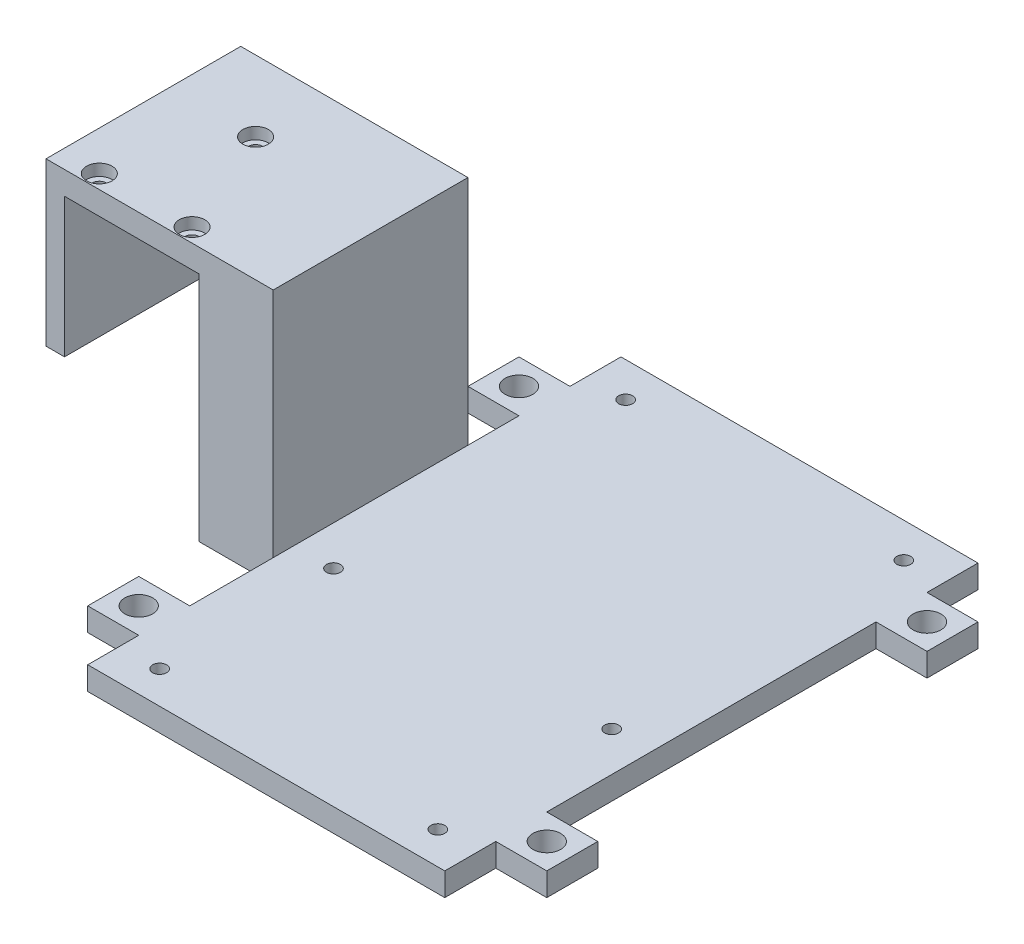
from build123d import *

# Parameters (mm, degrees)
SKETCH_1_W               = 4
SKETCH_1_H               = 42
SKETCH_1_W_2             = 29
SKETCH_1_W_3             = 16
EXTRUDE_2_DEPTH          = 90
CUT_EXTRUDE_3_DEPTH      = 30
CUT_EXTRUDE_3_DEPTH_BACK = 1
SKETCH_1_6_W             = 29
SKETCH_1_6_H             = 42
SKETCH_7_W               = 77
SKETCH_7_H               = 115
CUT_EXTRUDE_5_DEPTH      = 85
SKETCH_8_W               = 49
SKETCH_8_H               = 42
CUT_EXTRUDE_6_DEPTH      = 55
SKETCH_11_R              = 1.5
CUT_EXTRUDE_9_DEPTH      = 6
SKETCH_14_R              = 3
CUT_EXTRUDE_11_DEPTH     = 2
SKETCH_18_W              = 49
SKETCH_18_H              = 42
EXTRUDE_3_DEPTH          = 20
SKETCH_19_W              = 29
SKETCH_19_H              = 42
CUT_EXTRUDE_14_DEPTH     = 20
SKETCH_20_R              = 1.5
CUT_EXTRUDE_15_DEPTH     = 141.289878466
SKETCH_21_R              = 2.75
CUT_EXTRUDE_16_DEPTH     = 2.5
SKETCH_25_W              = 4
SKETCH_25_H              = 42
CUT_EXTRUDE_18_DEPTH     = 20
SKETCH_26_W              = 11
SKETCH_26_H              = 11
EXTRUDE_4_DEPTH          = 5
SKETCH_28_R              = 3
CUT_EXTRUDE_19_DEPTH     = 151.639470259


with BuildPart() as part:
    # 草图1 → 凸台-拉伸2 (new body)
    with BuildSketch(Plane(origin=(0, 0, 0), x_dir=(1, 0, 0), z_dir=(0, 1, 0))):
        with Locations((-16.5, 21)):
            Rectangle(SKETCH_1_W, SKETCH_1_H)
        with Locations((0, 21)):
            Rectangle(SKETCH_1_W_2, SKETCH_1_H)
        with Locations((22.5, 21)):
            Rectangle(SKETCH_1_W_3, SKETCH_1_H)
        with Locations((32.5, 21)):
            Rectangle(SKETCH_1_W, SKETCH_1_H)
        Polygon((30.5, 75), (30.5, 42), (34.5, 42), (34.5, 0), (30.5, 0), (30.5, -40), (107.5, -40), (107.5, 75), align=None)
    extrude(amount=EXTRUDE_2_DEPTH)

    # 草图1<6> → 切除-拉伸3 (cut, two sides: drawn at the far end of the back side and taken through both)
    with BuildSketch(Plane(origin=(0, 0, 0), x_dir=(1, 0, 0), z_dir=(0, 1, 0)).offset(-CUT_EXTRUDE_3_DEPTH_BACK)):
        with Locations((0, 21)):
            Rectangle(SKETCH_1_6_W, SKETCH_1_6_H)
    extrude(amount=CUT_EXTRUDE_3_DEPTH + CUT_EXTRUDE_3_DEPTH_BACK, mode=Mode.SUBTRACT)

    # 草图7 → 切除-拉伸5 (cut)
    with BuildSketch(Plane(origin=(0, 90, 0), x_dir=(1, 0, 0), z_dir=(0, 1, 0))):
        with Locations((69, 17.5)):
            Rectangle(SKETCH_7_W, SKETCH_7_H)
    extrude(amount=-CUT_EXTRUDE_5_DEPTH, mode=Mode.SUBTRACT)

    # 草图8 → 切除-拉伸6 (cut)
    with BuildSketch(Plane(origin=(0, 90, 0), x_dir=(1, 0, 0), z_dir=(0, 1, 0))):
        with Locations((6, 21)):
            Rectangle(SKETCH_8_W, SKETCH_8_H)
    extrude(amount=-CUT_EXTRUDE_6_DEPTH, mode=Mode.SUBTRACT)

    # 草图11 → 切除-拉伸9 (cut)
    with BuildSketch(Plane.XZ):
        with Locations(Location((39, 33, 0), (0, 0, 270))):
            Circle(SKETCH_11_R)
        with Locations(Location((99, 33, 0), (0, 0, 270))):
            Circle(SKETCH_11_R)
        with Locations(Location((39, -4.5, 0), (0, 0, 270))):
            Circle(SKETCH_11_R)
        with Locations(Location((99, -4.5, 0), (0, 0, 270))):
            Circle(SKETCH_11_R)
        with Locations(Location((99, -67.5, 0), (0, 0, 270))):
            Circle(SKETCH_11_R)
        with Locations(Location((39, -67.5, 0), (0, 0, 270))):
            Circle(SKETCH_11_R)
    extrude(amount=-CUT_EXTRUDE_9_DEPTH, mode=Mode.SUBTRACT)

    # 草图14 → 切除-拉伸11 (cut)
    with BuildSketch(Plane.XZ):
        with Locations(Location((39, 33, 0), (0, 0, 270))):
            Circle(SKETCH_14_R)
        with Locations(Location((99, 33, 0), (0, 0, 270))):
            Circle(SKETCH_14_R)
        with Locations(Location((39, -4.5, 0), (0, 0, 270))):
            Circle(SKETCH_14_R)
        with Locations(Location((99, -4.5, 0), (0, 0, 270))):
            Circle(SKETCH_14_R)
        with Locations(Location((39, -67.5, 0), (0, 0, 270))):
            Circle(SKETCH_14_R)
        with Locations(Location((99, -67.5, 0), (0, 0, 270))):
            Circle(SKETCH_14_R)
    extrude(amount=-CUT_EXTRUDE_11_DEPTH, mode=Mode.SUBTRACT)

    # 草图18 → 凸台-拉伸3 (add)
    with BuildSketch(Plane(origin=(0, 35, 0), x_dir=(1, 0, 0), z_dir=(0, 1, 0))):
        with Locations((6, 21)):
            Rectangle(SKETCH_18_W, SKETCH_18_H)
    extrude(amount=EXTRUDE_3_DEPTH)

    # 草图19 → 切除-拉伸14 (cut)
    with BuildSketch(Plane.XZ.offset(-30)):
        with Locations((0, -21)):
            Rectangle(SKETCH_19_W, SKETCH_19_H)
    extrude(amount=-CUT_EXTRUDE_14_DEPTH, mode=Mode.SUBTRACT)

    # 草图20 → 切除-拉伸15 (cut, through all)
    with BuildSketch(Plane.XZ.offset(-50)):
        with Locations(Location((-10, -3, 0), (0, 0, 270))):
            Circle(SKETCH_20_R)
        with Locations(Location((10, -3, 0), (0, 0, 270))):
            Circle(SKETCH_20_R)
        with Locations(Location((0, -26.7, 0), (0, 0, 270))):
            Circle(SKETCH_20_R)
    extrude(amount=-CUT_EXTRUDE_15_DEPTH, mode=Mode.SUBTRACT)

    # 草图21 → 切除-拉伸16 (cut)
    with BuildSketch(Plane(origin=(0, 55, 0), x_dir=(1, 0, 0), z_dir=(0, 1, 0))):
        with Locations(Location((0, 26.7, 0), (0, 0, 270))):
            Circle(SKETCH_21_R)
        with Locations(Location((-10, 3, 0), (0, 0, 270))):
            Circle(SKETCH_21_R)
        with Locations(Location((10, 3, 0), (0, 0, 270))):
            Circle(SKETCH_21_R)
    extrude(amount=-CUT_EXTRUDE_16_DEPTH, mode=Mode.SUBTRACT)

    # 草图25 → 切除-拉伸18 (cut)
    with BuildSketch(Plane.XZ):
        with Locations((-16.5, -21)):
            Rectangle(SKETCH_25_W, SKETCH_25_H)
    extrude(amount=-CUT_EXTRUDE_18_DEPTH, mode=Mode.SUBTRACT)

    # 草图26 → 凸台-拉伸4 (add)
    with BuildSketch(Plane.XZ):
        with Locations((25, 23.5)):
            Rectangle(SKETCH_26_W, SKETCH_26_H)
        with Locations((113, 23.5)):
            Rectangle(SKETCH_26_W, SKETCH_26_H)
        with Locations((25, -58.5)):
            Rectangle(SKETCH_26_W, SKETCH_26_H)
        with Locations((113, -58.5)):
            Rectangle(SKETCH_26_W, SKETCH_26_H)
    extrude(amount=-EXTRUDE_4_DEPTH)

    # 草图28 → 切除-拉伸19 (cut, through all)
    with BuildSketch(Plane.XZ):
        with Locations(Location((25, 23.5, 0), (0, 0, 270))):
            Circle(SKETCH_28_R)
        with Locations(Location((113, 23.5, 0), (0, 0, 270))):
            Circle(SKETCH_28_R)
        with Locations(Location((25, -58.5, 0), (0, 0, 270))):
            Circle(SKETCH_28_R)
        with Locations(Location((113, -58.5, 0), (0, 0, 270))):
            Circle(SKETCH_28_R)
    extrude(amount=-CUT_EXTRUDE_19_DEPTH, mode=Mode.SUBTRACT)


solid = part.part
